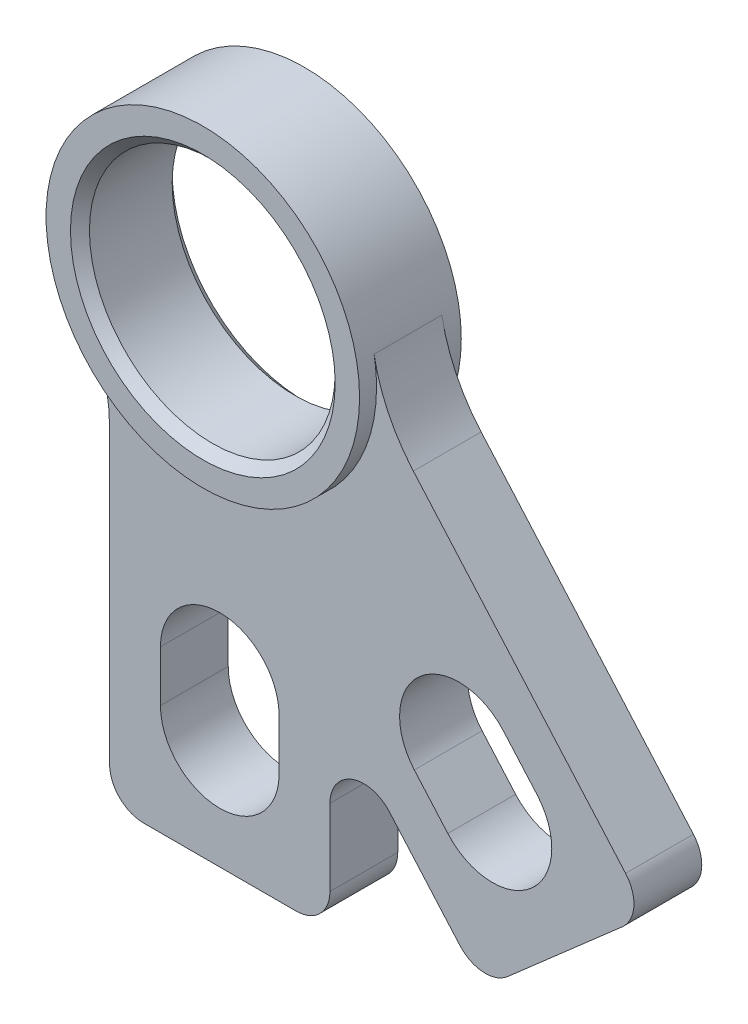
from build123d import *

# Parameters (mm, degrees)
SKETCH1_R           = 11.5062
BOSS_EXTRUDE2_DEPTH = 4.7625
BOSS_EXTRUDE3_DEPTH = 3.175
FILLET1_R           = 3.175
CHAMFER1_SIZE       = 0.889


with BuildPart() as part:
    # Sketch1 → Boss-Extrude2 (new, symmetric)
    with BuildSketch(Plane.XY):
        with BuildLine():
            ThreePointArc((14.44801476, 2.60624307), (-5.167651603, 13.741652388), (-12.585193267, -7.559797873))
            ThreePointArc((-12.585193267, -7.559797873), (5.167651603, -13.741652388), (14.44801476, 2.60624307))
        make_face()
        Circle(SKETCH1_R, mode=Mode.SUBTRACT)
    extrude(amount=BOSS_EXTRUDE2_DEPTH, both=True)

    # Sketch1<4> → Boss-Extrude3 (add, symmetric)
    with BuildSketch(Plane.XY):
        with BuildLine():
            ThreePointArc((-12.585193267, -7.559797873), (-10.89585042, -11.492870345), (-10.31875, -15.734319794))
            Line((-10.31875, -15.734319794), (-10.31875, -46.214319794))
            Line((-10.31875, -46.214319794), (10.31875, -46.214319794))
            Line((10.31875, -46.214319794), (10.31875, -27.439287025))
            Line((10.31875, -27.439287025), (24.57306791, -43.71137647))
            Line((24.57306791, -43.71137647), (40.096689185, -30.112715185))
            Line((40.096689185, -30.112715185), (18.129620955, -5.036096202))
            ThreePointArc((18.129620955, -5.036096202), (15.768901582, -1.465390058), (14.44801476, 2.60624307))
            ThreePointArc((14.44801476, 2.60624307), (5.167651603, -13.741652388), (-12.585193267, -7.559797873))
        make_face()
        with BuildLine():
            ThreePointArc((5.55625, -35.895569794), (0, -41.451819794), (-5.55625, -35.895569794))
            Line((-5.55625, -35.895569794), (-5.55625, -31.133069794))
            ThreePointArc((-5.55625, -31.133069794), (0, -25.576819794), (5.55625, -31.133069794))
            Line((5.55625, -31.133069794), (5.55625, -35.895569794))
        make_face(mode=Mode.SUBTRACT)
        with BuildLine():
            ThreePointArc((29.714984402, -25.489057152), (29.196725943, -33.329671687), (21.356111408, -32.811413228))
            Line((21.356111408, -32.811413228), (18.217958804, -29.229039088))
            ThreePointArc((18.217958804, -29.229039088), (18.736217262, -21.388424552), (26.576831798, -21.906683011))
            Line((26.576831798, -21.906683011), (29.714984402, -25.489057152))
        make_face(mode=Mode.SUBTRACT)
    extrude(amount=BOSS_EXTRUDE3_DEPTH, both=True)

    # Fillet1
    fillet1_edges = [part.edges().sort_by_distance(p)[0] for p in [
        (-10.31875, -46.214319794, 0),
        (40.096689185, -30.112715185, 0),
        (10.31875, -27.439287025, 0),
        (24.57306791, -43.71137647, 0),
        (10.31875, -46.214319794, 0),
    ]]
    fillet(fillet1_edges, radius=FILLET1_R)

    # Chamfer1
    chamfer1_edges = [part.edges().sort_by_distance(p)[0] for p in [
        (-11.5062, 0, -4.7625),
        (-11.5062, 0, 4.7625),
    ]]
    chamfer(chamfer1_edges, length=CHAMFER1_SIZE)


solid = part.part
